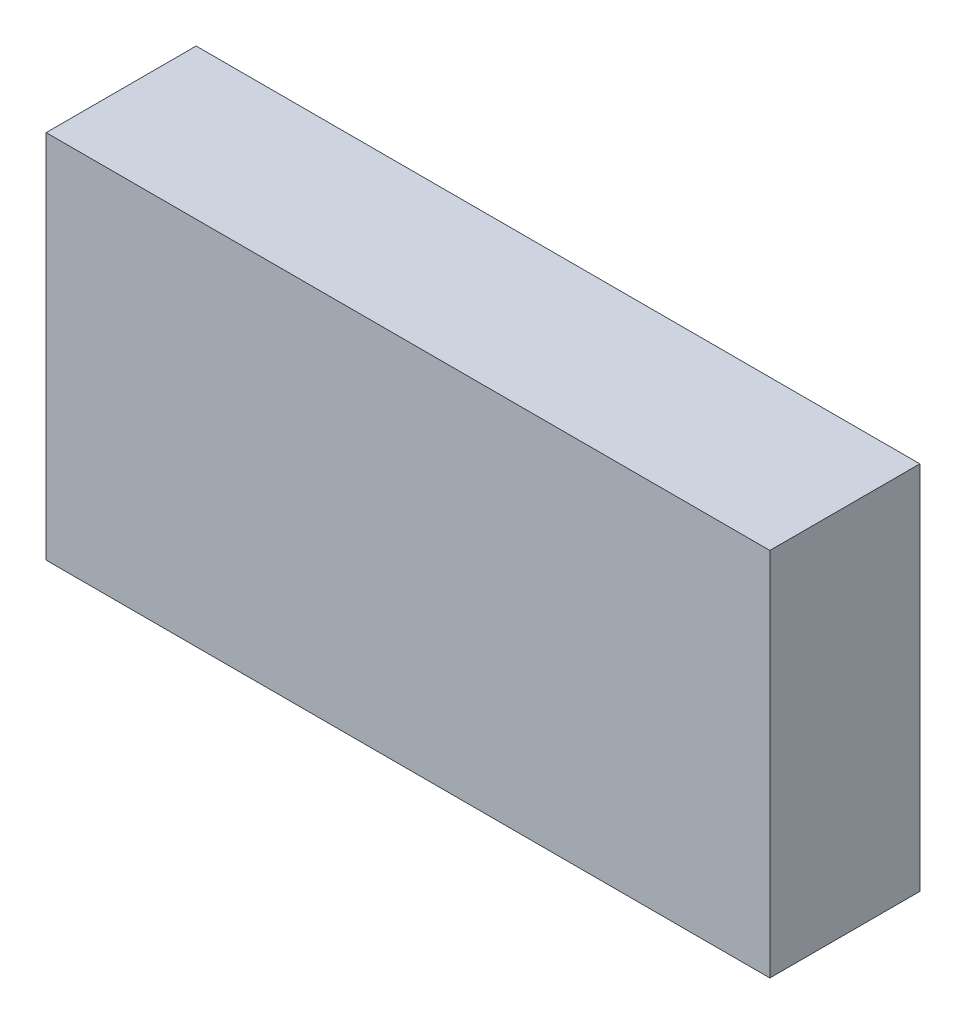
from build123d import *

# Parameters (mm, degrees)
SKETCH1_W           = 70.44
SKETCH1_H           = 36.04
BOSS_EXTRUDE1_DEPTH = 14.6


with BuildPart() as part:
    # Sketch1 → Boss-Extrude1 (new body)
    with BuildSketch(Plane.XY):
        Rectangle(SKETCH1_W, SKETCH1_H)
    extrude(amount=BOSS_EXTRUDE1_DEPTH)


solid = part.part
